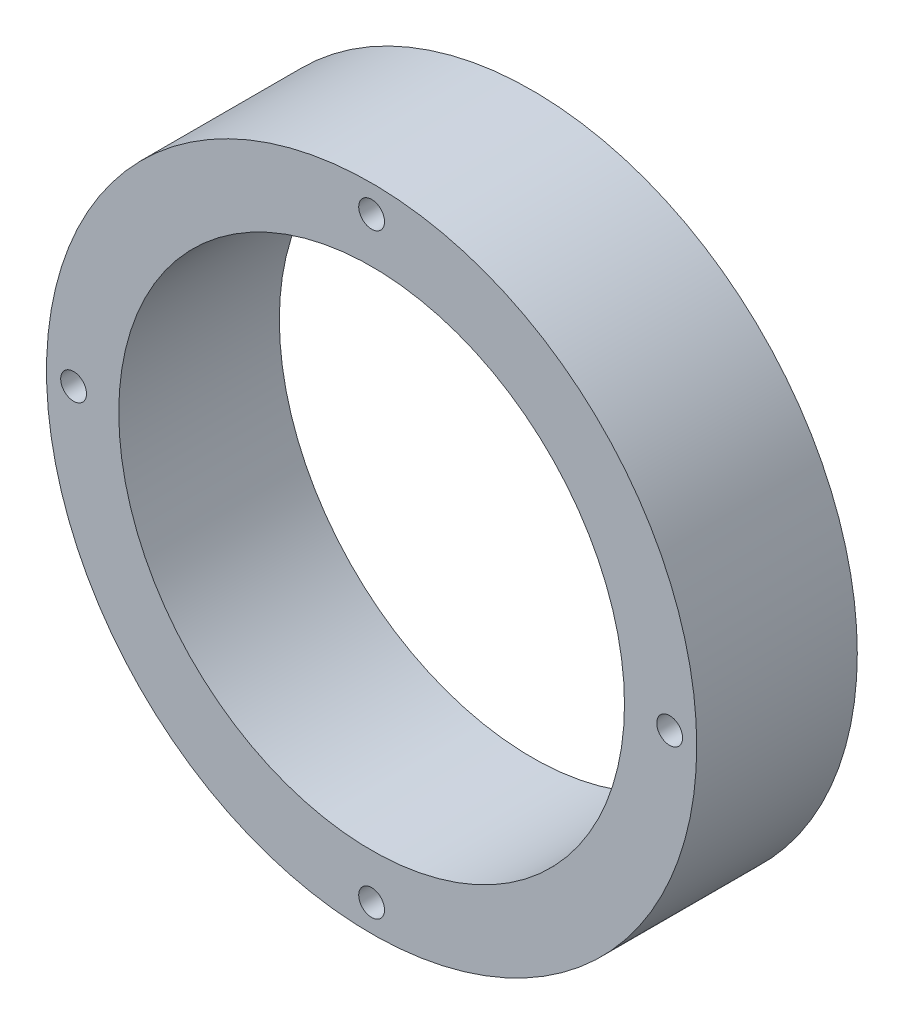
from build123d import *

# Parameters (mm, degrees)
SKETCH1_R           = 45
SKETCH1_R_2         = 35
SKETCH1_R_3         = 1.7859375
BOSS_EXTRUDE1_DEPTH = 22.225


with BuildPart() as part:
    # Sketch1 → Boss-Extrude1 (new body)
    with BuildSketch(Plane.XY):
        Circle(SKETCH1_R)
        Circle(SKETCH1_R_2, mode=Mode.SUBTRACT)
        with Locations((0, 41.25)):
            Circle(SKETCH1_R_3, mode=Mode.SUBTRACT)
        with Locations((41.25, 0)):
            Circle(SKETCH1_R_3, mode=Mode.SUBTRACT)
        with Locations((0, -41.25)):
            Circle(SKETCH1_R_3, mode=Mode.SUBTRACT)
        with Locations((-41.25, 0)):
            Circle(SKETCH1_R_3, mode=Mode.SUBTRACT)
    extrude(amount=BOSS_EXTRUDE1_DEPTH)


solid = part.part
